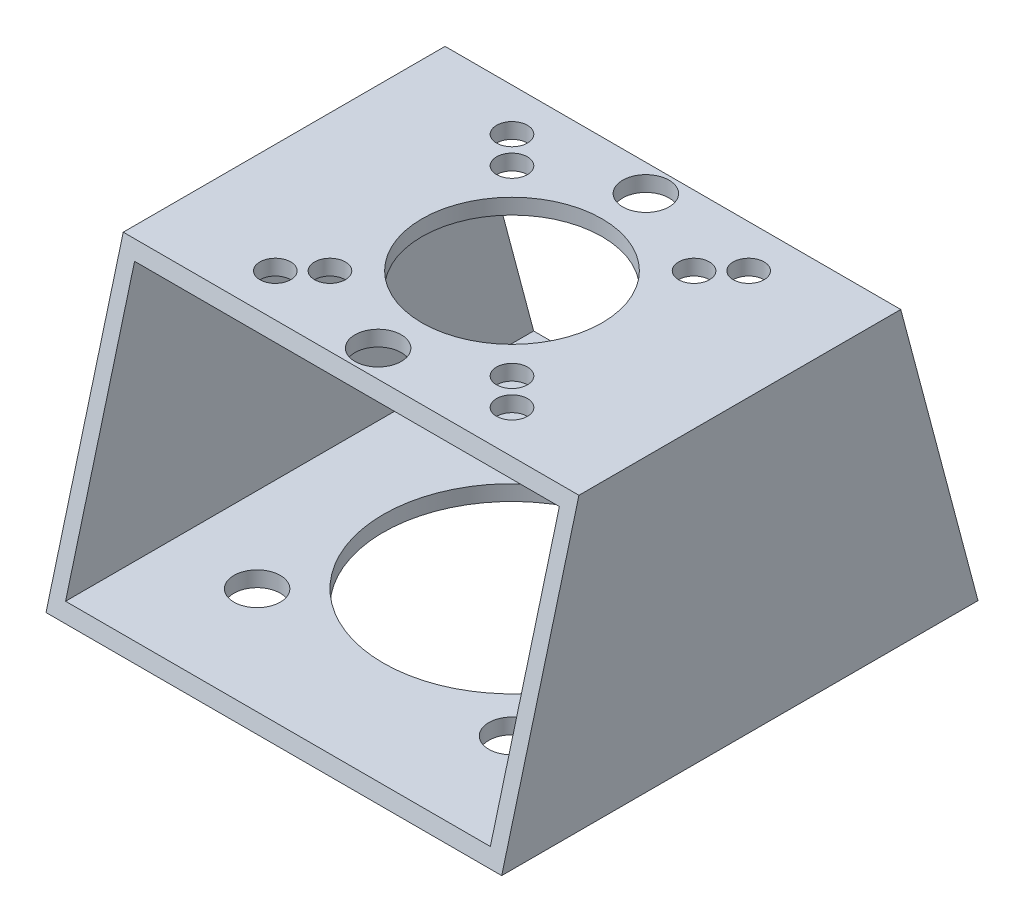
from build123d import *

# Parameters (mm, degrees)
SKETCH1_W           = 177
SKETCH1_H           = 112.94900091
SKETCH1_W_2         = 165
SKETCH1_H_2         = 100.94900091
EXTRUDE_THIN1_DEPTH = 92.5
CUT_EXTRUDE1_REACH  = 172.722
SKETCH2_R           = 35
SKETCH2_R_2         = 6
SKETCH3_R           = 50
SKETCH3_R_2         = 9
CUT_EXTRUDE2_DEPTH  = 10
CUT_EXTRUDE3_DEPTH  = 208.544258417
CIRPATTERN1_COUNT   = 4
SKETCH5_R           = 9
CUT_EXTRUDE4_DEPTH  = 10


with BuildPart() as part:
    # Sketch1 → Extrude-Thin1 (new, symmetric)
    with BuildSketch(Plane.XY):
        Rectangle(SKETCH1_W, SKETCH1_H)
        Rectangle(SKETCH1_W_2, SKETCH1_H_2, mode=Mode.SUBTRACT)
    extrude(amount=EXTRUDE_THIN1_DEPTH, both=True)

    # Sketch2 → Cut-Extrude1 (cut, up to next)
    with BuildSketch(Plane(origin=(0, 56.474500455, 0), x_dir=(1, 0, 0), z_dir=(0, 1, 0)), mode=Mode.PRIVATE) as cut_extrude1_sk1:
        with Locations(Location((0, 0, 0), (0, 0, 270))):
            Circle(SKETCH2_R)
    cut_extrude1_tool1 = extrude(cut_extrude1_sk1.sketch, amount=-CUT_EXTRUDE1_REACH, mode=Mode.PRIVATE) & part.part
    # Sketch2 → Cut-Extrude1 (cut, up to next)
    with BuildSketch(Plane(origin=(0, 56.474500455, 0), x_dir=(1, 0, 0), z_dir=(0, 1, 0)), mode=Mode.PRIVATE) as cut_extrude1_sk2:
        with Locations(Location((-35.355339059, -35.355339059, 0), (0, 0, 270))):
            Circle(SKETCH2_R_2)
    cut_extrude1_tool2 = extrude(cut_extrude1_sk2.sketch, amount=-CUT_EXTRUDE1_REACH, mode=Mode.PRIVATE) & part.part
    # Sketch2 → Cut-Extrude1 (cut, up to next)
    with BuildSketch(Plane(origin=(0, 56.474500455, 0), x_dir=(1, 0, 0), z_dir=(0, 1, 0)), mode=Mode.PRIVATE) as cut_extrude1_sk3:
        with Locations(Location((-45.961940777, -45.961940777, 0), (0, 0, 270))):
            Circle(SKETCH2_R_2)
    cut_extrude1_tool3 = extrude(cut_extrude1_sk3.sketch, amount=-CUT_EXTRUDE1_REACH, mode=Mode.PRIVATE) & part.part
    cut_extrude1_1 = cut_extrude1_tool1.solids().sort_by_distance((0, 56.4745, 0))[0]
    add(cut_extrude1_1, mode=Mode.SUBTRACT)
    cut_extrude1_2 = cut_extrude1_tool2.solids().sort_by_distance((-35.355339, 56.4745, 35.355339))[0]
    add(cut_extrude1_2, mode=Mode.SUBTRACT)
    cut_extrude1_3 = cut_extrude1_tool3.solids().sort_by_distance((-45.961941, 56.4745, 45.961941))[0]
    add(cut_extrude1_3, mode=Mode.SUBTRACT)
    cut_extrude1 = cut_extrude1_1 + cut_extrude1_2 + cut_extrude1_3  # Cut-Extrude1 as one shape, for the pattern or mirror that repeats it

    # Sketch3 → Cut-Extrude2 (cut)
    with BuildSketch(Plane.XZ.offset(56.474500455)):
        with Locations(Location((0, 0, 0), (0, 0, 270))):
            Circle(SKETCH3_R)
        with Locations(Location((-49.497474683, -49.497474683, 0), (0, 0, 270))):
            Circle(SKETCH3_R_2)
    cut_extrude2 = extrude(amount=-CUT_EXTRUDE2_DEPTH, mode=Mode.SUBTRACT)

    # Sketch4 → Cut-Extrude3 (cut, through all)
    with BuildSketch(Plane.ZY.offset(88.5)):
        Polygon((-92.5, -56.474500455), (-62.5, 56.474500455), (-92.5, 56.474500455), align=None)
    cut_extrude3 = extrude(amount=-CUT_EXTRUDE3_DEPTH, mode=Mode.SUBTRACT)

    # Mirror1: Cut-Extrude3 across plane
    add(cut_extrude3.mirror(Plane.XY), mode=Mode.SUBTRACT)

    # CirPattern1: Cut-Extrude1, Cut-Extrude2 ×4 about axis
    cirpattern1_axis = Axis((0, 0, 0), (0, 1, 0))
    add([cut_extrude1.rotate(cirpattern1_axis, i * 360 / CIRPATTERN1_COUNT) for i in range(1, CIRPATTERN1_COUNT)], mode=Mode.SUBTRACT)
    add([cut_extrude2.rotate(cirpattern1_axis, i * 360 / CIRPATTERN1_COUNT) for i in range(1, CIRPATTERN1_COUNT)], mode=Mode.SUBTRACT)

    # Sketch5 → Cut-Extrude4 (cut)
    with BuildSketch(Plane(origin=(0, 56.474500455, 0), x_dir=(1, 0, 0), z_dir=(0, 1, 0))):
        with Locations(Location((0, -52, 0), (0, 0, 270))):
            Circle(SKETCH5_R)
    cut_extrude4 = extrude(amount=-CUT_EXTRUDE4_DEPTH, mode=Mode.SUBTRACT)

    # Mirror2: Cut-Extrude4 across plane
    add(cut_extrude4.mirror(Plane.XY), mode=Mode.SUBTRACT)


solid = part.part
